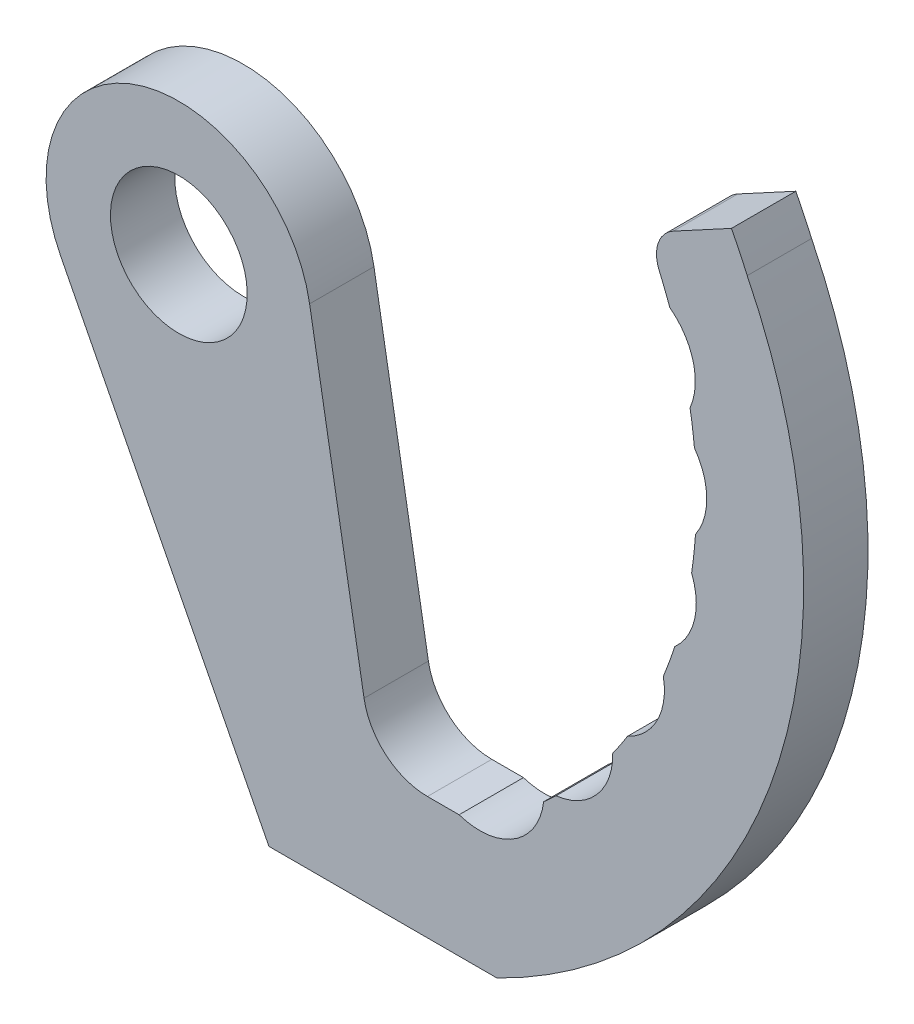
from build123d import *

# Parameters (mm, degrees)
ESQUISSE1_R             = 4.125
ESQUISSE1_R_2           = 2.125
BOSS_EXTRU_1_DEPTH      = 2
BOSS_EXTRU_2_START      = -2
BOSS_EXTRU_2_DEPTH      = 2
ENL_V_MAT_EXTRU_1_DEPTH = 48.690657123
BOSS_EXTRU_3_START      = -2
BOSS_EXTRU_3_DEPTH      = 2
CONG_1_R                = 1
CONG_2_R                = 2


with BuildPart() as part:
    # Esquisse1 → Boss.-Extru.1 (new body)
    with BuildSketch(Plane.XY):
        with Locations(Location((22.625964543, -8.5, 0), (0, 0, 270))):
            Circle(ESQUISSE1_R)
        with Locations(Location((22.625964543, -8.5, 0), (0, 0, 270))):
            Circle(ESQUISSE1_R_2, mode=Mode.SUBTRACT)
    extrude(amount=BOSS_EXTRU_1_DEPTH)

    # Esquisse2 → Boss.-Extru.2 (add)
    with BuildSketch(Plane.XY.offset(2).offset(BOSS_EXTRU_2_START)):
        with BuildLine():
            Line((30.509764166, -23.030033129), (25.42611418, -23.030033129))
            Line((25.42611418, -23.030033129), (18.953657758, -10.378772971))
            ThreePointArc((18.953657758, -10.378772971), (23.931920923, -12.412812663), (26.690529558, -7.796482951))
            Line((26.690529558, -7.796482951), (28.668432745, -19.223805295))
            Line((28.668432745, -19.223805295), (31.625964543, -19.223805295))
            ThreePointArc((31.625964543, -19.223805295), (38.131775725, -11.04447664), (37.160125022, -0.638570082))
            Line((37.160125022, -0.638570082), (39.798855089, 0.788701312))
            ThreePointArc((39.798855089, 0.788701312), (40.551713625, -13.225604632), (30.509764166, -23.030033129))
        make_face()
    extrude(amount=BOSS_EXTRU_2_DEPTH)

    # Esquisse3 → Enlèv. mat.-Extru.1 (cut, through all)
    with BuildSketch(Plane.XY.offset(2)):
        with BuildLine():
            ThreePointArc((38.167376486, -5.226235195), (36.438745559, -1.907826674), (35.54029783, -5.540014951))
            ThreePointArc((35.54029783, -5.540014951), (35.031758868, -6.882600454), (35.553780718, -8.220001253))
            ThreePointArc((35.553780718, -8.220001253), (34.75530459, -9.413141471), (34.961960594, -10.833859953))
            ThreePointArc((34.961960594, -10.833859953), (33.914765028, -11.815964406), (33.795387502, -13.246662387))
            ThreePointArc((33.795387502, -13.246662387), (32.553529245, -13.967034361), (32.114280515, -15.333858513))
            ThreePointArc((32.114280515, -15.333858513), (30.552699493, -18.734073905), (33.972916342, -17.21680112))
            ThreePointArc((33.972916342, -17.21680112), (35.668723842, -16.476130338), (36.031089318, -14.661454735))
            ThreePointArc((36.031089318, -14.661454735), (37.515935524, -13.55710514), (37.459320378, -11.707469768))
            ThreePointArc((37.459320378, -11.707469768), (38.656556802, -10.296448426), (38.183883536, -8.507332369))
            ThreePointArc((38.183883536, -8.507332369), (39.031708248, -6.862476892), (38.167376486, -5.226235195))
        make_face()
    extrude(amount=-ENL_V_MAT_EXTRU_1_DEPTH, mode=Mode.SUBTRACT)

    # Esquisse4 → Boss.-Extru.3 (add)
    with BuildSketch(Plane.XY.offset(2).offset(BOSS_EXTRU_3_START)):
        with BuildLine():
            Line((30.509764166, -23.030033129), (32.509764166, -23.030033129))
            ThreePointArc((32.509764166, -23.030033129), (41.131762211, -13.249116028), (40.289284919, -0.23775862))
            ThreePointArc((40.289284919, -0.23775862), (40.336178222, -13.75207443), (30.509764166, -23.030033129))
        make_face()
    extrude(amount=BOSS_EXTRU_3_DEPTH)

    # Congé1
    cong_1_edges = [part.edges().sort_by_distance(p)[0] for p in [
        (37.160125022, -0.638570082, 1),
    ]]
    fillet(cong_1_edges, radius=CONG_1_R)

    # Congé2
    cong_2_edges = [part.edges().sort_by_distance(p)[0] for p in [
        (28.668432745, -19.223805295, 1),
    ]]
    fillet(cong_2_edges, radius=CONG_2_R)


solid = part.part
